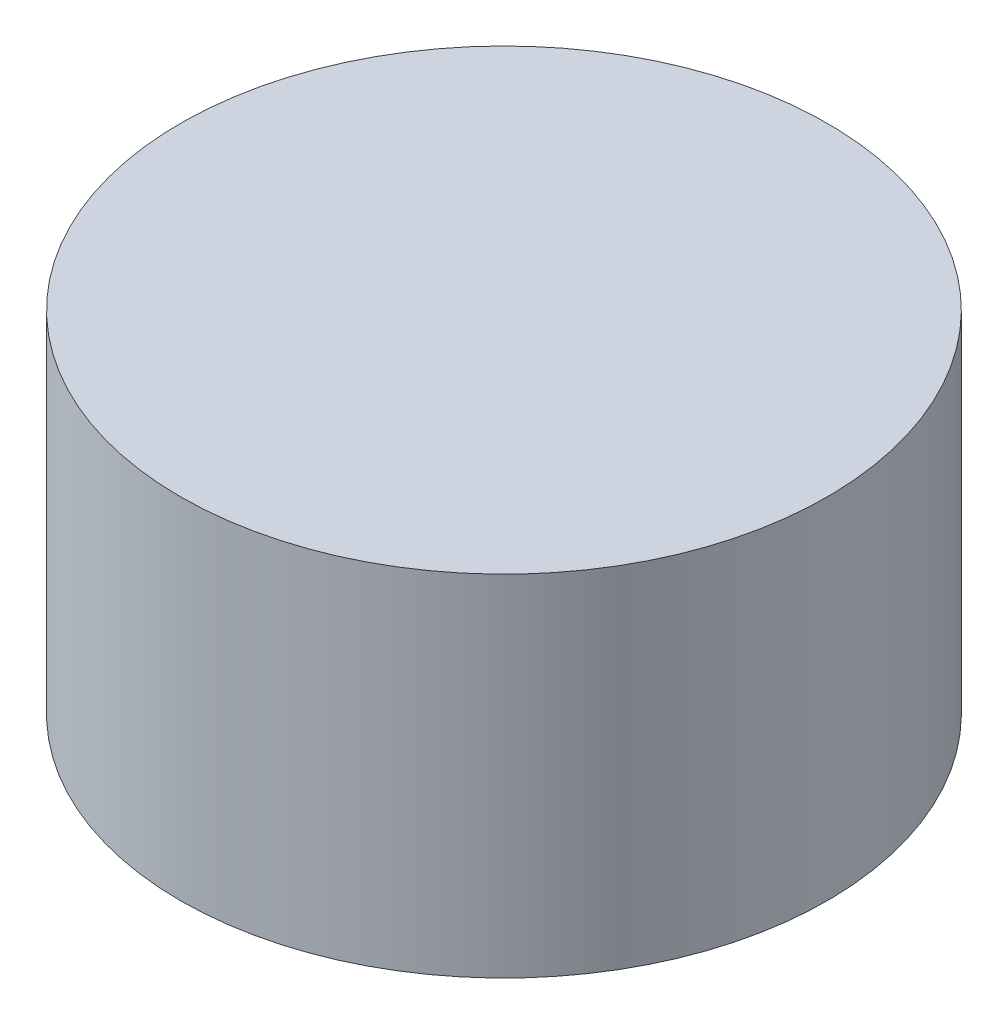
from build123d import *

# Parameters (mm, degrees)
SKETCH2_R           = 1.7145
BOSS_EXTRUDE1_DEPTH = 1.8542


with BuildPart() as part:
    # Sketch2 → Boss-Extrude1 (new body)
    with BuildSketch(Plane(origin=(0, 0, 0), x_dir=(1, 0, 0), z_dir=(0, 1, 0))):
        with Locations(Location((0, 0, 0), (0, 0, 270))):
            Circle(SKETCH2_R)
    extrude(amount=BOSS_EXTRUDE1_DEPTH)


solid = part.part
